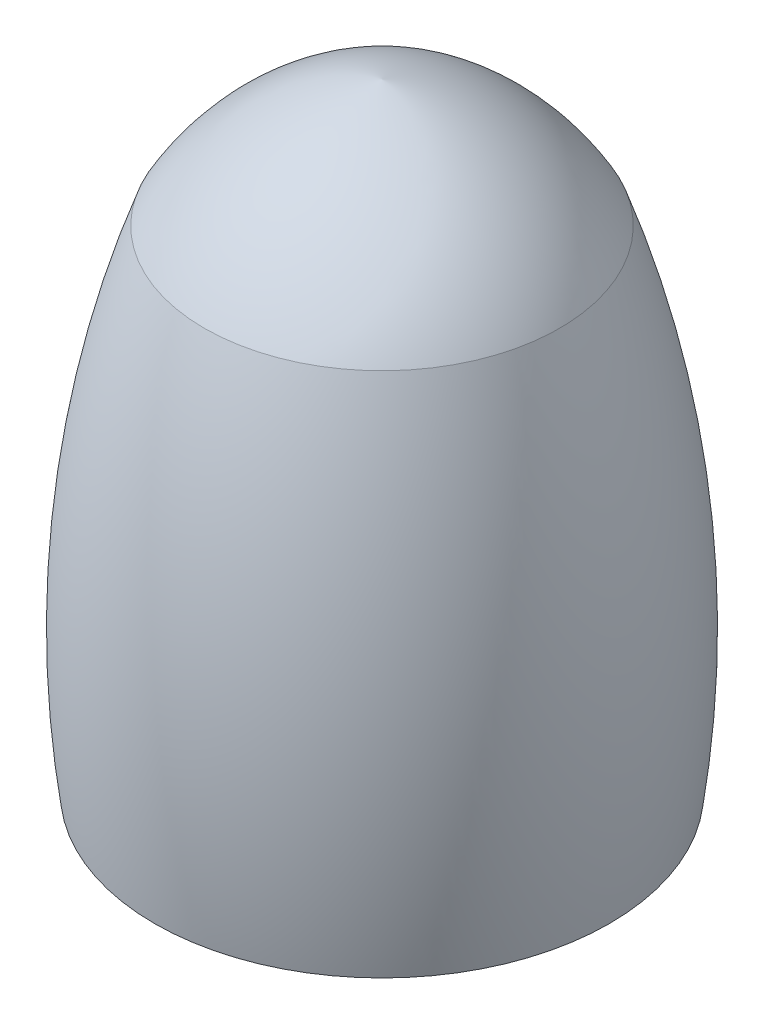
from build123d import *


with BuildPart() as part:
    # 스케치1 → 회전1 (revolve)
    with BuildSketch(Plane(origin=(0, 0, 0), x_dir=(0, 0, -1), z_dir=(1, 0, 0)), mode=Mode.PRIVATE) as revolve_1_sk:
        with BuildLine():
            Line((0, 0), (0.820348404, 0))
            Line((0.820348404, 0), (1.28050857, -0.544977229))
            Line((1.28050857, -0.544977229), (2.78050857, -0.544977229))
            ThreePointArc((2.78050857, -0.544977229), (2.834640853, 2.490147127), (2.171761805, 5.452494427))
            ThreePointArc((2.171761805, 5.452494427), (1.256856501, 6.466193538), (0, 7))
            Line((0, 7), (0, 0))
        make_face()
    revolve(revolve_1_sk.sketch.rotate(Axis((0, 7, 0), (0, -1, 0)), 180), axis=Axis((0, 7, 0), (0, -1, 0)))


solid = part.part
